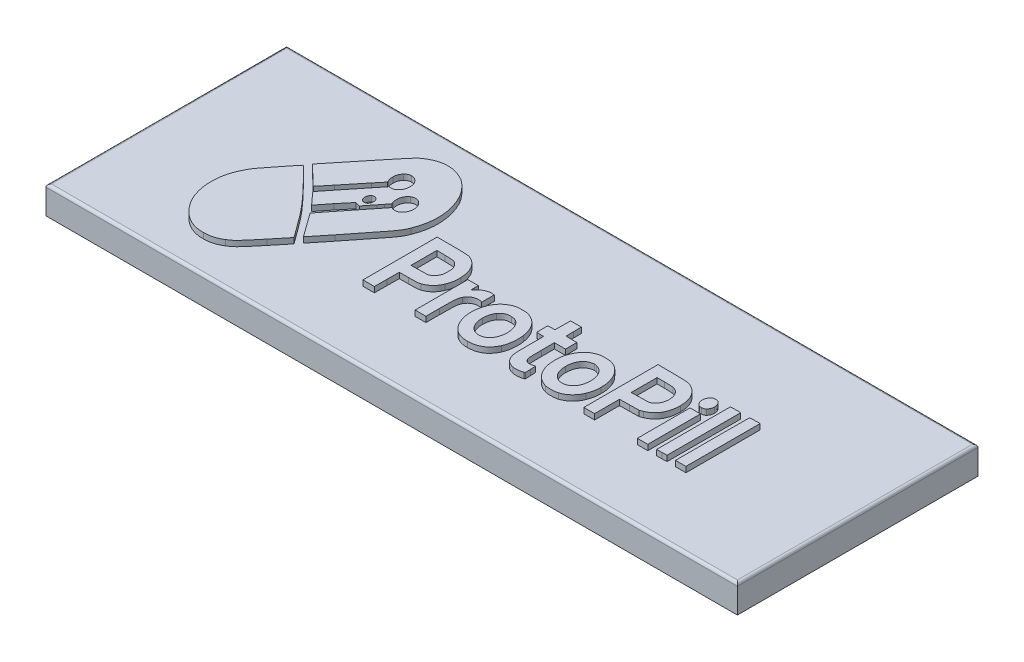
from build123d import *

# Parameters (mm, degrees)
SKETCH1_W           = 250
SKETCH1_H           = 87
BOSS_EXTRUDE1_DEPTH = 10
BOSS_EXTRUDE2_DEPTH = 2
SKETCH5_R           = 3.075
CUT_EXTRUDE1_DEPTH  = 3
FILLET1_R           = 1


with BuildPart() as part:
    # Sketch1 → Boss-Extrude1 (new body)
    with BuildSketch(Plane(origin=(0, 0, 0), x_dir=(1, 0, 0), z_dir=(0, 1, 0))):
        Rectangle(SKETCH1_W, SKETCH1_H)
    extrude(amount=BOSS_EXTRUDE1_DEPTH)

    # Sketch3 → Boss-Extrude2 (add)
    # profile 1 of 14: a face of its own
    with BuildSketch(Plane(origin=(0, 10, 0), x_dir=(1, 0, 0), z_dir=(0, 1, 0))):
        with BuildLine():
            add(Edge.make_bspline(
                [(-71.462865957, 20.776977785), (-75.096341957, 16.274388785), (-78.741614957, 11.771798785), (-79.567404957, 10.769655785)],
                knots=[0, 0, 0, 0, 1, 1, 1, 1], degree=3))
            Line((-79.567404957, 10.769655785), (-81.065623957, 8.920629785))
            Line((-81.065623957, 8.920629785), (-79.154509957, 7.085718785))
            add(Edge.make_bspline(
                [(-79.154509957, 7.085718785), (-78.104576957, 6.083574785), (-76.535575957, 4.545072785), (-75.662597957, 3.669960785)],
                knots=[0, 0, 0, 0, 1, 1, 1, 1], degree=3))
            add(Edge.make_bspline(
                [(-75.662597957, 3.669960785), (-74.789619957, 2.794849785), (-74.022814957, 2.103229785), (-73.952032957, 2.117343785)],
                knots=[0, 0, 0, 0, 1, 1, 1, 1], degree=3))
            add(Edge.make_bspline(
                [(-73.952032957, 2.117343785), (-73.869453957, 2.145573785), (-72.312249957, 4.036943785), (-70.471917957, 6.323524785)],
                knots=[0, 0, 0, 0, 1, 1, 1, 1], degree=3))
            add(Edge.make_bspline(
                [(-70.471917957, 6.323524785), (-68.619788957, 8.610105785), (-65.930072957, 11.927060785), (-64.467244957, 13.677283785)],
                knots=[0, 0, 0, 0, 1, 1, 1, 1], degree=3))
            Line((-64.467244957, 13.677283785), (-61.824716957, 16.867205785))
            Line((-61.824716957, 16.867205785), (-62.155032957, 17.558825785))
            add(Edge.make_bspline(
                [(-62.155032957, 17.558825785), (-62.449957957, 18.165757785), (-62.497145957, 18.391593785), (-62.497145957, 19.379622785)],
                knots=[0, 0, 0, 0, 1, 1, 1, 1], degree=3))
            add(Edge.make_bspline(
                [(-62.497145957, 19.379622785), (-62.497145957, 20.706403785), (-62.261205957, 21.355680785), (-61.494400957, 22.188447785)],
                knots=[0, 0, 0, 0, 1, 1, 1, 1], degree=3))
            add(Edge.make_bspline(
                [(-61.494400957, 22.188447785), (-60.833768957, 22.908297785), (-60.279309957, 23.162361785), (-59.429925957, 23.162361785)],
                knots=[0, 0, 0, 0, 1, 1, 1, 1], degree=3))
            add(Edge.make_bspline(
                [(-59.429925957, 23.162361785), (-58.545150957, 23.176476785), (-57.825533957, 22.809494785), (-57.164901957, 22.004956785)],
                knots=[0, 0, 0, 0, 1, 1, 1, 1], degree=3))
            add(Edge.make_bspline(
                [(-57.164901957, 22.004956785), (-56.480675957, 21.172188785), (-56.256532957, 20.424109785), (-56.327314957, 19.097328785)],
                knots=[0, 0, 0, 0, 1, 1, 1, 1], degree=3))
            add(Edge.make_bspline(
                [(-56.327314957, 19.097328785), (-56.374502957, 18.250446785), (-56.445284957, 17.925807785), (-56.716615957, 17.460022785)],
                knots=[0, 0, 0, 0, 1, 1, 1, 1], degree=3))
            add(Edge.make_bspline(
                [(-56.716615957, 17.460022785), (-57.424435957, 16.161470785), (-58.238428957, 15.610997785), (-59.429925957, 15.625111785)],
                knots=[0, 0, 0, 0, 1, 1, 1, 1], degree=3))
            Line((-59.429925957, 15.625111785), (-60.173136957, 15.625111785))
            Line((-60.173136957, 15.625111785), (-61.694949957, 13.705512785))
            add(Edge.make_bspline(
                [(-61.694949957, 13.705512785), (-62.520739957, 12.646910785), (-65.257643957, 9.231152785), (-67.770404957, 6.125918785)],
                knots=[0, 0, 0, 0, 1, 1, 1, 1], degree=3))
            add(Edge.make_bspline(
                [(-67.770404957, 6.125918785), (-70.294962957, 3.020684785), (-72.347640957, 0.437694785), (-72.347640957, 0.395350785)],
                knots=[0, 0, 0, 0, 1, 1, 1, 1], degree=3))
            add(Edge.make_bspline(
                [(-72.347640957, 0.395350785), (-72.347640957, 0.338891785), (-71.734196957, -0.380958215), (-70.979188957, -1.213725215)],
                knots=[0, 0, 0, 0, 1, 1, 1, 1], degree=3))
            Line((-70.979188957, -1.213725215), (-69.598939957, -2.752227215))
            Line((-69.598939957, -2.752227215), (-68.336660957, -4.107238215))
            add(Edge.make_bspline(
                [(-64.785763957, 0.395350785), (-66.732268957, -2.032377215), (-68.336660957, -4.050779215), (-68.336660957, -4.107238215)],
                knots=[0, 0, 0, 0, 1, 1, 1, 1], degree=3))
            add(Edge.make_bspline(
                [(-61.034317957, 4.700334785), (-61.175881957, 4.756792785), (-62.166829957, 3.627616785), (-64.785763957, 0.395350785)],
                knots=[0, 0, 0, 0, 1, 1, 1, 1], degree=3))
            add(Edge.make_bspline(
                [(-60.161339957, 4.432154785), (-60.538843957, 4.530957785), (-60.928144957, 4.643875785), (-61.034317957, 4.700334785)],
                knots=[0, 0, 0, 0, 1, 1, 1, 1], degree=3))
            Line((-60.161339957, 4.432154785), (-59.477113957, 4.262778785))
            Line((-59.477113957, 4.262778785), (-56.598645957, 7.847912785))
            Line((-56.598645957, 7.847912785), (-55.430742957, 9.344070785))
            Line((-55.430742957, 9.344070785), (-54.274636957, 10.854343785))
            Line((-54.274636957, 10.854343785), (-54.522373957, 11.545963785))
            add(Edge.make_bspline(
                [(-54.522373957, 11.545963785), (-55.171208957, 13.352645785), (-54.569561957, 15.455735785), (-53.130327957, 16.387305785)],
                knots=[0, 0, 0, 0, 1, 1, 1, 1], degree=3))
            add(Edge.make_bspline(
                [(-53.130327957, 16.387305785), (-51.903439957, 17.191843785), (-50.605769957, 16.980123785), (-49.555836957, 15.822717785)],
                knots=[0, 0, 0, 0, 1, 1, 1, 1], degree=3))
            add(Edge.make_bspline(
                [(-49.555836957, 15.822717785), (-47.892459957, 13.945462785), (-48.423324957, 10.572049785), (-50.570378957, 9.499331785)],
                knots=[0, 0, 0, 0, 1, 1, 1, 1], degree=3))
            add(Edge.make_bspline(
                [(-50.570378957, 9.499331785), (-51.065852957, 9.245267785), (-52.033206957, 9.231152785), (-52.646650957, 9.442873785)],
                knots=[0, 0, 0, 0, 1, 1, 1, 1], degree=3))
            Line((-52.646650957, 9.442873785), (-53.083139957, 9.598134785))
            Line((-53.083139957, 9.598134785), (-54.085884957, 8.356041785))
            add(Edge.make_bspline(
                [(-54.085884957, 8.356041785), (-54.994253957, 7.212750785), (-58.521556957, 2.766620785), (-63.995364957, -4.107238215)],
                knots=[0, 0, 0, 0, 1, 1, 1, 1], degree=3))
            add(Edge.make_bspline(
                [(-63.995364957, -4.107238215), (-65.151470957, -5.546938215), (-66.095230957, -6.789031215), (-66.095230957, -6.845490215)],
                knots=[0, 0, 0, 0, 1, 1, 1, 1], degree=3))
            add(Edge.make_bspline(
                [(-66.095230957, -6.845490215), (-66.095230957, -6.916064215), (-65.387410957, -7.932322215), (-64.526229957, -9.103842215)],
                knots=[0, 0, 0, 0, 1, 1, 1, 1], degree=3))
            add(Edge.make_bspline(
                [(-64.526229957, -9.103842215), (-63.665048957, -10.289477215), (-62.296596957, -12.166732215), (-61.506197957, -13.295908215)],
                knots=[0, 0, 0, 0, 1, 1, 1, 1], degree=3))
            add(Edge.make_bspline(
                [(-61.506197957, -13.295908215), (-60.704001957, -14.425084215), (-60.007978957, -15.384884215), (-59.972587957, -15.441342215)],
                knots=[0, 0, 0, 0, 1, 1, 1, 1], degree=3))
            add(Edge.make_bspline(
                [(-59.972587957, -15.441342215), (-59.925399957, -15.511916215), (-57.601390957, -12.674861215), (-54.817298957, -9.160301215)],
                knots=[0, 0, 0, 0, 1, 1, 1, 1], degree=3))
            add(Edge.make_bspline(
                [(-54.817298957, -9.160301215), (-44.011246957, 4.418040785), (-44.376953957, 3.909910785), (-43.220847957, 6.704621785)],
                knots=[0, 0, 0, 0, 1, 1, 1, 1], degree=3))
            add(Edge.make_bspline(
                [(-43.220847957, 6.704621785), (-40.731680957, 12.675139785), (-41.097387957, 19.436080785), (-44.223592957, 25.194878785)],
                knots=[0, 0, 0, 0, 1, 1, 1, 1], degree=3))
            add(Edge.make_bspline(
                [(-44.223592957, 25.194878785), (-45.391495957, 27.354427785), (-47.597534957, 29.768041785), (-49.473257957, 30.953675785)],
                knots=[0, 0, 0, 0, 1, 1, 1, 1], degree=3))
            add(Edge.make_bspline(
                [(-49.473257957, 30.953675785), (-50.511393957, 31.602952785), (-52.457898957, 32.365145785), (-53.755568957, 32.647440785)],
                knots=[0, 0, 0, 0, 1, 1, 1, 1], degree=3))
            add(Edge.make_bspline(
                [(-53.755568957, 32.647440785), (-55.029644957, 32.901504785), (-56.976149957, 32.901504785), (-58.250225957, 32.619210785)],
                knots=[0, 0, 0, 0, 1, 1, 1, 1], degree=3))
            add(Edge.make_bspline(
                [(-58.250225957, 32.619210785), (-60.255715957, 32.195769785), (-62.556130957, 31.010134785), (-64.089740957, 29.626894785)],
                knots=[0, 0, 0, 0, 1, 1, 1, 1], degree=3))
            add(Edge.make_bspline(
                [(-64.089740957, 29.626894785), (-64.514432957, 29.245797785), (-67.829389957, 25.265451785), (-71.462865957, 20.776977785)],
                knots=[0, 0, 0, 0, 1, 1, 1, 1], degree=3))
        make_face()
        with BuildLine():
            add(Edge.make_bspline(
                [(-58.887263957, 9.668708785), (-59.382737957, 10.063920785), (-60.007978957, 10.092149785), (-60.515249957, 9.711052785)],
                knots=[0, 0, 0, 0, 1, 1, 1, 1], degree=3))
            add(Edge.make_bspline(
                [(-58.191240957, 8.087861785), (-58.191240957, 8.821826785), (-58.391789957, 9.273496785), (-58.887263957, 9.668708785)],
                knots=[0, 0, 0, 0, 1, 1, 1, 1], degree=3))
            add(Edge.make_bspline(
                [(-60.373685957, 6.408212785), (-59.359143957, 5.829509785), (-58.191240957, 6.732850785), (-58.191240957, 8.087861785)],
                knots=[0, 0, 0, 0, 1, 1, 1, 1], degree=3))
            add(Edge.make_bspline(
                [(-60.515249957, 9.711052785), (-61.565182957, 8.948858785), (-61.482603957, 7.029259785), (-60.373685957, 6.408212785)],
                knots=[0, 0, 0, 0, 1, 1, 1, 1], degree=3))
        make_face(mode=Mode.SUBTRACT)
        with BuildLine():
            add(Edge.make_bspline(
                [(-64.655996957, 20.833436785), (-66.519922957, 18.292790785), (-67.640637957, 16.881320785), (-73.491949957, 9.668708785)],
                knots=[0, 0, 0, 0, 1, 1, 1, 1], degree=3))
            Line((-73.491949957, 9.668708785), (-75.756973957, 6.859883785))
            Line((-75.756973957, 6.859883785), (-76.653545957, 7.833797785))
            add(Edge.make_bspline(
                [(-76.653545957, 7.833797785), (-77.137222957, 8.356041785), (-77.538320957, 8.821826785), (-77.538320957, 8.864170785)],
                knots=[0, 0, 0, 0, 1, 1, 1, 1], degree=3))
            add(Edge.make_bspline(
                [(-77.538320957, 8.864170785), (-77.538320957, 8.906514785), (-75.509236957, 11.433045785), (-73.020069957, 14.453591785)],
                knots=[0, 0, 0, 0, 1, 1, 1, 1], degree=3))
            add(Edge.make_bspline(
                [(-73.020069957, 14.453591785), (-70.542699957, 17.488252785), (-67.345712957, 21.412138785), (-65.918275957, 23.176476785)],
                knots=[0, 0, 0, 0, 1, 1, 1, 1], degree=3))
            add(Edge.make_bspline(
                [(-65.918275957, 23.176476785), (-62.591521957, 27.297968785), (-61.565182957, 28.243653785), (-59.370940957, 29.203453785)],
                knots=[0, 0, 0, 0, 1, 1, 1, 1], degree=3))
            add(Edge.make_bspline(
                [(-59.370940957, 29.203453785), (-57.448029957, 30.036220785), (-55.418945957, 30.205596785), (-53.295485957, 29.683352785)],
                knots=[0, 0, 0, 0, 1, 1, 1, 1], degree=3))
            add(Edge.make_bspline(
                [(-53.295485957, 29.683352785), (-50.747333957, 29.048191785), (-48.470512957, 27.340312785), (-46.724556957, 24.714978785)],
                knots=[0, 0, 0, 0, 1, 1, 1, 1], degree=3))
            add(Edge.make_bspline(
                [(-46.724556957, 24.714978785), (-45.792593957, 23.317623785), (-44.813442957, 20.861665785), (-45.179149957, 20.861665785)],
                knots=[0, 0, 0, 0, 1, 1, 1, 1], degree=3))
            add(Edge.make_bspline(
                [(-45.179149957, 20.861665785), (-45.226337957, 20.861665785), (-45.745405957, 21.454482785), (-46.347052957, 22.188447785)],
                knots=[0, 0, 0, 0, 1, 1, 1, 1], degree=3))
            add(Edge.make_bspline(
                [(-46.347052957, 22.188447785), (-49.603024957, 26.140563785), (-54.085884957, 27.862556785), (-58.014285957, 26.648692785)],
                knots=[0, 0, 0, 0, 1, 1, 1, 1], degree=3))
            add(Edge.make_bspline(
                [(-58.014285957, 26.648692785), (-59.264767957, 26.267595785), (-60.916347957, 25.279566785), (-61.871904957, 24.319767785)],
                knots=[0, 0, 0, 0, 1, 1, 1, 1], degree=3))
            add(Edge.make_bspline(
                [(-61.871904957, 24.319767785), (-62.308393957, 23.896326785), (-63.558875957, 22.329594785), (-64.655996957, 20.833436785)],
                knots=[0, 0, 0, 0, 1, 1, 1, 1], degree=3))
        make_face(mode=Mode.SUBTRACT)
    # profile 2 of 14: a face of its own
    with BuildSketch(Plane(origin=(0, 10, 0), x_dir=(1, 0, 0), z_dir=(0, 1, 0))):
        with BuildLine():
            Line((-75.756973957, 6.859883785), (-73.491949957, 9.668708785))
            add(Edge.make_bspline(
                [(-64.655996957, 20.833436785), (-66.519922957, 18.292790785), (-67.640637957, 16.881320785), (-73.491949957, 9.668708785)],
                knots=[0, 0, 0, 0, 1, 1, 1, 1], degree=3))
            add(Edge.make_bspline(
                [(-61.871904957, 24.319767785), (-62.308393957, 23.896326785), (-63.558875957, 22.329594785), (-64.655996957, 20.833436785)],
                knots=[0, 0, 0, 0, 1, 1, 1, 1], degree=3))
            add(Edge.make_bspline(
                [(-58.014285957, 26.648692785), (-59.264767957, 26.267595785), (-60.916347957, 25.279566785), (-61.871904957, 24.319767785)],
                knots=[0, 0, 0, 0, 1, 1, 1, 1], degree=3))
            add(Edge.make_bspline(
                [(-46.347052957, 22.188447785), (-49.603024957, 26.140563785), (-54.085884957, 27.862556785), (-58.014285957, 26.648692785)],
                knots=[0, 0, 0, 0, 1, 1, 1, 1], degree=3))
            add(Edge.make_bspline(
                [(-45.179149957, 20.861665785), (-45.226337957, 20.861665785), (-45.745405957, 21.454482785), (-46.347052957, 22.188447785)],
                knots=[0, 0, 0, 0, 1, 1, 1, 1], degree=3))
            add(Edge.make_bspline(
                [(-46.724556957, 24.714978785), (-45.792593957, 23.317623785), (-44.813442957, 20.861665785), (-45.179149957, 20.861665785)],
                knots=[0, 0, 0, 0, 1, 1, 1, 1], degree=3))
            add(Edge.make_bspline(
                [(-53.295485957, 29.683352785), (-50.747333957, 29.048191785), (-48.470512957, 27.340312785), (-46.724556957, 24.714978785)],
                knots=[0, 0, 0, 0, 1, 1, 1, 1], degree=3))
            add(Edge.make_bspline(
                [(-59.370940957, 29.203453785), (-57.448029957, 30.036220785), (-55.418945957, 30.205596785), (-53.295485957, 29.683352785)],
                knots=[0, 0, 0, 0, 1, 1, 1, 1], degree=3))
            add(Edge.make_bspline(
                [(-65.918275957, 23.176476785), (-62.591521957, 27.297968785), (-61.565182957, 28.243653785), (-59.370940957, 29.203453785)],
                knots=[0, 0, 0, 0, 1, 1, 1, 1], degree=3))
            add(Edge.make_bspline(
                [(-73.020069957, 14.453591785), (-70.542699957, 17.488252785), (-67.345712957, 21.412138785), (-65.918275957, 23.176476785)],
                knots=[0, 0, 0, 0, 1, 1, 1, 1], degree=3))
            add(Edge.make_bspline(
                [(-77.538320957, 8.864170785), (-77.538320957, 8.906514785), (-75.509236957, 11.433045785), (-73.020069957, 14.453591785)],
                knots=[0, 0, 0, 0, 1, 1, 1, 1], degree=3))
            add(Edge.make_bspline(
                [(-76.653545957, 7.833797785), (-77.137222957, 8.356041785), (-77.538320957, 8.821826785), (-77.538320957, 8.864170785)],
                knots=[0, 0, 0, 0, 1, 1, 1, 1], degree=3))
            Line((-76.653545957, 7.833797785), (-75.756973957, 6.859883785))
        make_face()
    # profile 3 of 14: a face of its own
    with BuildSketch(Plane(origin=(0, 10, 0), x_dir=(1, 0, 0), z_dir=(0, 1, 0))):
        with BuildLine():
            Line((-35.658970957, 8.581876785), (-35.658970957, -4.827088215))
            Line((-35.658970957, -4.827088215), (-35.658970957, -18.236053215))
            Line((-35.658970957, -18.236053215), (-33.594495957, -18.236053215))
            Line((-33.594495957, -18.236053215), (-31.530020957, -18.236053215))
            Line((-31.530020957, -18.236053215), (-31.506426957, -13.747578215))
            Line((-31.506426957, -13.747578215), (-31.471035957, -9.273218215))
            Line((-31.471035957, -9.273218215), (-28.167875957, -9.259104215))
            add(Edge.make_bspline(
                [(-28.167875957, -9.259104215), (-25.195031957, -9.244989215), (-24.770339957, -9.216760215), (-23.944549957, -8.948580215)],
                knots=[0, 0, 0, 0, 1, 1, 1, 1], degree=3))
            add(Edge.make_bspline(
                [(-23.944549957, -8.948580215), (-21.915465957, -8.285189215), (-20.381855957, -6.817261215), (-19.508877957, -4.685941215)],
                knots=[0, 0, 0, 0, 1, 1, 1, 1], degree=3))
            add(Edge.make_bspline(
                [(-19.508877957, -4.685941215), (-18.848245957, -3.062750215), (-18.635899957, -1.778313215), (-18.706681957, 0.183630785)],
                knots=[0, 0, 0, 0, 1, 1, 1, 1], degree=3))
            add(Edge.make_bspline(
                [(-18.706681957, 0.183630785), (-18.836448957, 3.698190785), (-20.157712957, 6.281180785), (-22.505315957, 7.678535785)],
                knots=[0, 0, 0, 0, 1, 1, 1, 1], degree=3))
            add(Edge.make_bspline(
                [(-22.505315957, 7.678535785), (-23.956346957, 8.525417785), (-24.369241957, 8.581876785), (-30.314929957, 8.581876785)],
                knots=[0, 0, 0, 0, 1, 1, 1, 1], degree=3))
            Line((-30.314929957, 8.581876785), (-35.658970957, 8.581876785))
        make_face()
        with BuildLine():
            add(Edge.make_bspline(
                [(-23.106962957, -2.441704215), (-23.472669957, -3.373274215), (-24.027128957, -4.050779215), (-24.782136957, -4.502450215)],
                knots=[0, 0, 0, 0, 1, 1, 1, 1], degree=3))
            Line((-24.782136957, -4.502450215), (-25.454565957, -4.897662215))
            Line((-25.454565957, -4.897662215), (-28.486394957, -4.940006215))
            Line((-28.486394957, -4.940006215), (-31.530020957, -4.982350215))
            Line((-31.530020957, -4.982350215), (-31.530020957, -0.310384215))
            Line((-31.530020957, -0.310384215), (-31.530020957, 4.375695785))
            Line((-31.530020957, 4.375695785), (-28.545379957, 4.319237785))
            add(Edge.make_bspline(
                [(-28.545379957, 4.319237785), (-26.079806957, 4.262778785), (-25.478159957, 4.220434785), (-25.029873957, 4.008713785)],
                knots=[0, 0, 0, 0, 1, 1, 1, 1], degree=3))
            add(Edge.make_bspline(
                [(-25.029873957, 4.008713785), (-24.286662957, 3.684075785), (-23.567045957, 2.907767785), (-23.177744957, 2.032655785)],
                knots=[0, 0, 0, 0, 1, 1, 1, 1], degree=3))
            add(Edge.make_bspline(
                [(-23.177744957, 2.032655785), (-22.882819957, 1.383379785), (-22.859225957, 1.171658785), (-22.859225957, -0.239811215)],
                knots=[0, 0, 0, 0, 1, 1, 1, 1], degree=3))
            add(Edge.make_bspline(
                [(-22.859225957, -0.239811215), (-22.859225957, -1.524248215), (-22.906413957, -1.905345215), (-23.106962957, -2.441704215)],
                knots=[0, 0, 0, 0, 1, 1, 1, 1], degree=3))
        make_face(mode=Mode.SUBTRACT)
    # profile 4 of 14: a face of its own
    with BuildSketch(Plane(origin=(0, 10, 0), x_dir=(1, 0, 0), z_dir=(0, 1, 0))):
        with BuildLine():
            Line((44.206719043, 8.595991785), (44.206719043, -4.812973215))
            Line((44.206719043, -4.812973215), (44.206719043, -18.236053215))
            Line((44.206719043, -18.236053215), (46.153224043, -18.236053215))
            Line((46.153224043, -18.236053215), (48.099729043, -18.236053215))
            Line((48.099729043, -18.236053215), (48.099729043, -13.733464215))
            Line((48.099729043, -13.733464215), (48.099729043, -9.230874215))
            Line((48.099729043, -9.230874215), (51.615235043, -9.174416215))
            Line((51.615235043, -9.174416215), (55.118944043, -9.117957215))
            Line((55.118944043, -9.117957215), (56.227862043, -8.666286215))
            add(Edge.make_bspline(
                [(56.227862043, -8.666286215), (59.436646043, -7.339505215), (61.123617043, -4.431876215), (61.123617043, -0.239811215)],
                knots=[0, 0, 0, 0, 1, 1, 1, 1], degree=3))
            add(Edge.make_bspline(
                [(61.123617043, -0.239811215), (61.123617043, 2.413752785), (60.462985043, 4.375695785), (59.023751043, 6.013001785)],
                knots=[0, 0, 0, 0, 1, 1, 1, 1], degree=3))
            add(Edge.make_bspline(
                [(59.023751043, 6.013001785), (58.044600043, 7.113947785), (57.089043043, 7.763223785), (55.803170043, 8.186664785)],
                knots=[0, 0, 0, 0, 1, 1, 1, 1], degree=3))
            add(Edge.make_bspline(
                [(55.803170043, 8.186664785), (54.930192043, 8.483073785), (54.576282043, 8.497188785), (49.550760043, 8.553647785)],
                knots=[0, 0, 0, 0, 1, 1, 1, 1], degree=3))
            Line((49.550760043, 8.553647785), (44.206719043, 8.595991785))
        make_face()
        with BuildLine():
            add(Edge.make_bspline(
                [(55.024568043, -4.558909215), (54.434718043, -4.883547215), (54.269560043, -4.897662215), (51.261325043, -4.940006215)],
                knots=[0, 0, 0, 0, 1, 1, 1, 1], degree=3))
            Line((51.261325043, -4.940006215), (48.099729043, -4.982350215))
            Line((48.099729043, -4.982350215), (48.099729043, -0.324499215))
            Line((48.099729043, -0.324499215), (48.099729043, 4.347466785))
            Line((48.099729043, 4.347466785), (50.718663043, 4.347466785))
            add(Edge.make_bspline(
                [(50.718663043, 4.347466785), (52.157897043, 4.347466785), (53.667913043, 4.276893785), (54.069011043, 4.192204785)],
                knots=[0, 0, 0, 0, 1, 1, 1, 1], degree=3))
            add(Edge.make_bspline(
                [(54.069011043, 4.192204785), (55.543636043, 3.881681785), (56.640757043, 2.696046785), (57.006464043, 1.030512785)],
                knots=[0, 0, 0, 0, 1, 1, 1, 1], degree=3))
            add(Edge.make_bspline(
                [(57.006464043, 1.030512785), (57.242404043, -0.098663215), (57.230607043, -0.804398215), (56.935682043, -1.933575215)],
                knots=[0, 0, 0, 0, 1, 1, 1, 1], degree=3))
            add(Edge.make_bspline(
                [(56.935682043, -1.933575215), (56.640757043, -3.105095215), (55.932937043, -4.079009215), (55.024568043, -4.558909215)],
                knots=[0, 0, 0, 0, 1, 1, 1, 1], degree=3))
        make_face(mode=Mode.SUBTRACT)
    # profile 5 of 14: a face of its own
    with BuildSketch(Plane(origin=(0, 10, 0), x_dir=(1, 0, 0), z_dir=(0, 1, 0))):
        with BuildLine():
            add(Edge.make_bspline(
                [(72.755459043, 8.497188785), (71.941466043, 8.511303785), (71.103879043, 8.497188785), (70.903330043, 8.468958785)],
                knots=[0, 0, 0, 0, 1, 1, 1, 1], degree=3))
            Line((70.903330043, 8.468958785), (70.514029043, 8.426614785))
            Line((70.514029043, 8.426614785), (70.514029043, -4.911776215))
            Line((70.514029043, -4.911776215), (70.514029043, -18.250168215))
            Line((70.514029043, -18.250168215), (72.377955043, -18.207824215))
            Line((72.377955043, -18.207824215), (74.230084043, -18.165479215))
            Line((74.230084043, -18.165479215), (74.230084043, -4.841203215))
            Line((74.230084043, -4.841203215), (74.230084043, 8.483073785))
            Line((74.230084043, 8.483073785), (72.755459043, 8.497188785))
        make_face()
    # profile 6 of 14: a face of its own
    with BuildSketch(Plane(origin=(0, 10, 0), x_dir=(1, 0, 0), z_dir=(0, 1, 0))):
        with BuildLine():
            add(Edge.make_bspline(
                [(77.427071043, 8.468958785), (77.391680043, 8.426614785), (77.356289043, 2.399637785), (77.356289043, -4.925891215)],
                knots=[0, 0, 0, 0, 1, 1, 1, 1], degree=3))
            Line((77.356289043, -4.925891215), (77.356289043, -18.236053215))
            Line((77.356289043, -18.236053215), (79.243809043, -18.236053215))
            Line((79.243809043, -18.236053215), (81.131329043, -18.236053215))
            Line((81.131329043, -18.236053215), (81.131329043, -4.827088215))
            Line((81.131329043, -4.827088215), (81.131329043, 8.595991785))
            Line((81.131329043, 8.595991785), (79.314591043, 8.567761785))
            add(Edge.make_bspline(
                [(79.314591043, 8.567761785), (78.311846043, 8.567761785), (77.462462043, 8.525417785), (77.427071043, 8.468958785)],
                knots=[0, 0, 0, 0, 1, 1, 1, 1], degree=3))
        make_face()
    # profile 7 of 14: a face of its own
    with BuildSketch(Plane(origin=(0, 10, 0), x_dir=(1, 0, 0), z_dir=(0, 1, 0))):
        with BuildLine():
            add(Edge.make_bspline(
                [(-73.102648957, -30.431154215), (-71.203331957, -29.273748215), (-70.448323957, -28.483325215), (-65.812102957, -22.823331215)],
                knots=[0, 0, 0, 0, 1, 1, 1, 1], degree=3))
            Line((-65.812102957, -22.823331215), (-61.400024957, -17.445630215))
            Line((-61.400024957, -17.445630215), (-62.709491957, -15.610719215))
            add(Edge.make_bspline(
                [(-62.709491957, -15.610719215), (-67.086178957, -9.484939215), (-69.174247957, -6.845490215), (-72.701550957, -2.992177215)],
                knots=[0, 0, 0, 0, 1, 1, 1, 1], degree=3))
            add(Edge.make_bspline(
                [(-72.701550957, -2.992177215), (-75.780567957, 0.381235785), (-81.962195957, 6.676392785), (-82.375090957, 6.859883785)],
                knots=[0, 0, 0, 0, 1, 1, 1, 1], degree=3))
            add(Edge.make_bspline(
                [(-82.375090957, 6.859883785), (-82.422278957, 6.873997785), (-84.097452957, 4.827366785), (-86.102942957, 2.286720785)],
                knots=[0, 0, 0, 0, 1, 1, 1, 1], degree=3))
            add(Edge.make_bspline(
                [(-86.102942957, 2.286720785), (-88.108432957, -0.253925215), (-89.972358957, -2.653424215), (-90.255486957, -3.048636215)],
                knots=[0, 0, 0, 0, 1, 1, 1, 1], degree=3))
            add(Edge.make_bspline(
                [(-90.255486957, -3.048636215), (-91.458780957, -4.756514215), (-92.662074957, -7.410078215), (-93.287315957, -9.696659215)],
                knots=[0, 0, 0, 0, 1, 1, 1, 1], degree=3))
            add(Edge.make_bspline(
                [(-93.287315957, -9.696659215), (-94.172090957, -12.971270215), (-94.148496957, -16.937501215), (-93.228330957, -20.240340215)],
                knots=[0, 0, 0, 0, 1, 1, 1, 1], degree=3))
            add(Edge.make_bspline(
                [(-93.228330957, -20.240340215), (-92.520510957, -22.780986215), (-91.494171957, -24.785274215), (-89.889779957, -26.789561215)],
                knots=[0, 0, 0, 0, 1, 1, 1, 1], degree=3))
            add(Edge.make_bspline(
                [(-89.889779957, -26.789561215), (-86.928732957, -30.501727215), (-83.519399957, -32.266065215), (-79.366855957, -32.251950215)],
                knots=[0, 0, 0, 0, 1, 1, 1, 1], degree=3))
            add(Edge.make_bspline(
                [(-79.366855957, -32.251950215), (-77.019252957, -32.237835215), (-75.202514957, -31.715591215), (-73.102648957, -30.431154215)],
                knots=[0, 0, 0, 0, 1, 1, 1, 1], degree=3))
        make_face()
        with BuildLine():
            add(Edge.make_bspline(
                [(-90.338065957, -7.141899215), (-89.701027957, -5.801002215), (-89.075786957, -4.911776215), (-85.560280957, -0.507990215)],
                knots=[0, 0, 0, 0, 1, 1, 1, 1], degree=3))
            Line((-85.560280957, -0.507990215), (-82.339699957, 3.528813785))
            Line((-82.339699957, 3.528813785), (-81.419533957, 2.427867785))
            Line((-81.419533957, 2.427867785), (-80.499367957, 1.341035785))
            Line((-80.499367957, 1.341035785), (-81.230781957, 0.381235785))
            add(Edge.make_bspline(
                [(-81.230781957, 0.381235785), (-81.631879957, -0.141008215), (-82.870564957, -1.735969215), (-83.991279957, -3.161553215)],
                knots=[0, 0, 0, 0, 1, 1, 1, 1], degree=3))
            add(Edge.make_bspline(
                [(-83.991279957, -3.161553215), (-85.100197957, -4.587138215), (-86.386070957, -6.280902215), (-86.834356957, -6.930178215)],
                knots=[0, 0, 0, 0, 1, 1, 1, 1], degree=3))
            add(Edge.make_bspline(
                [(-86.834356957, -6.930178215), (-88.828049957, -9.809577215), (-89.901576957, -12.928926215), (-90.125719957, -16.542289215)],
                knots=[0, 0, 0, 0, 1, 1, 1, 1], degree=3))
            add(Edge.make_bspline(
                [(-90.125719957, -16.542289215), (-90.220095957, -17.981988215), (-90.231892957, -18.024332215), (-90.503223957, -18.024332215)],
                knots=[0, 0, 0, 0, 1, 1, 1, 1], degree=3))
            add(Edge.make_bspline(
                [(-90.503223957, -18.024332215), (-90.750960957, -18.024332215), (-90.845336957, -17.897300215), (-91.057682957, -17.248024215)],
                knots=[0, 0, 0, 0, 1, 1, 1, 1], degree=3))
            add(Edge.make_bspline(
                [(-91.057682957, -17.248024215), (-91.423389957, -16.161192215), (-91.694720957, -14.481543215), (-91.694720957, -13.324137215)],
                knots=[0, 0, 0, 0, 1, 1, 1, 1], degree=3))
            add(Edge.make_bspline(
                [(-91.694720957, -13.324137215), (-91.694720957, -11.404538215), (-91.128464957, -8.835663215), (-90.338065957, -7.141899215)],
                knots=[0, 0, 0, 0, 1, 1, 1, 1], degree=3))
        make_face(mode=Mode.SUBTRACT)
    # profile 8 of 14: a face of its own
    with BuildSketch(Plane(origin=(0, 10, 0), x_dir=(1, 0, 0), z_dir=(0, 1, 0))):
        with BuildLine():
            Line((-82.339699957, 3.528813785), (-85.560280957, -0.507990215))
            add(Edge.make_bspline(
                [(-90.338065957, -7.141899215), (-89.701027957, -5.801002215), (-89.075786957, -4.911776215), (-85.560280957, -0.507990215)],
                knots=[0, 0, 0, 0, 1, 1, 1, 1], degree=3))
            add(Edge.make_bspline(
                [(-91.694720957, -13.324137215), (-91.694720957, -11.404538215), (-91.128464957, -8.835663215), (-90.338065957, -7.141899215)],
                knots=[0, 0, 0, 0, 1, 1, 1, 1], degree=3))
            add(Edge.make_bspline(
                [(-91.057682957, -17.248024215), (-91.423389957, -16.161192215), (-91.694720957, -14.481543215), (-91.694720957, -13.324137215)],
                knots=[0, 0, 0, 0, 1, 1, 1, 1], degree=3))
            add(Edge.make_bspline(
                [(-90.503223957, -18.024332215), (-90.750960957, -18.024332215), (-90.845336957, -17.897300215), (-91.057682957, -17.248024215)],
                knots=[0, 0, 0, 0, 1, 1, 1, 1], degree=3))
            add(Edge.make_bspline(
                [(-90.125719957, -16.542289215), (-90.220095957, -17.981988215), (-90.231892957, -18.024332215), (-90.503223957, -18.024332215)],
                knots=[0, 0, 0, 0, 1, 1, 1, 1], degree=3))
            add(Edge.make_bspline(
                [(-86.834356957, -6.930178215), (-88.828049957, -9.809577215), (-89.901576957, -12.928926215), (-90.125719957, -16.542289215)],
                knots=[0, 0, 0, 0, 1, 1, 1, 1], degree=3))
            add(Edge.make_bspline(
                [(-83.991279957, -3.161553215), (-85.100197957, -4.587138215), (-86.386070957, -6.280902215), (-86.834356957, -6.930178215)],
                knots=[0, 0, 0, 0, 1, 1, 1, 1], degree=3))
            add(Edge.make_bspline(
                [(-81.230781957, 0.381235785), (-81.631879957, -0.141008215), (-82.870564957, -1.735969215), (-83.991279957, -3.161553215)],
                knots=[0, 0, 0, 0, 1, 1, 1, 1], degree=3))
            Line((-81.230781957, 0.381235785), (-80.499367957, 1.341035785))
            Line((-80.499367957, 1.341035785), (-81.419533957, 2.427867785))
            Line((-81.419533957, 2.427867785), (-82.339699957, 3.528813785))
        make_face()
    # profile 9 of 14: a face of its own
    with BuildSketch(Plane(origin=(0, 10, 0), x_dir=(1, 0, 0), z_dir=(0, 1, 0))):
        with BuildLine():
            Line((14.714219043, 6.464671785), (14.690625043, 3.684075785))
            Line((14.690625043, 3.684075785), (14.655234043, 0.889365785))
            Line((14.655234043, 0.889365785), (13.381158043, 0.847020785))
            Line((13.381158043, 0.847020785), (12.107082043, 0.804676785))
            Line((12.107082043, 0.804676785), (12.142473043, -1.199610215))
            Line((12.142473043, -1.199610215), (12.177864043, -3.203897215))
            Line((12.177864043, -3.203897215), (13.451940043, -3.246242215))
            Line((13.451940043, -3.246242215), (14.714219043, -3.288586215))
            Line((14.714219043, -3.288586215), (14.714219043, -8.398107215))
            add(Edge.make_bspline(
                [(14.714219043, -8.398107215), (14.714219043, -12.928926215), (14.737813043, -13.620546215), (14.926565043, -14.453313215)],
                knots=[0, 0, 0, 0, 1, 1, 1, 1], degree=3))
            add(Edge.make_bspline(
                [(14.926565043, -14.453313215), (15.469227043, -16.782239215), (16.719709043, -18.038447215), (18.843169043, -18.405429215)],
                knots=[0, 0, 0, 0, 1, 1, 1, 1], degree=3))
            add(Edge.make_bspline(
                [(18.843169043, -18.405429215), (19.845914043, -18.574806215), (21.332336043, -18.433659215), (22.276096043, -18.080791215)],
                knots=[0, 0, 0, 0, 1, 1, 1, 1], degree=3))
            Line((22.276096043, -18.080791215), (22.688991043, -17.925530215))
            Line((22.688991043, -17.925530215), (22.641803043, -15.991816215))
            add(Edge.make_bspline(
                [(22.641803043, -15.991816215), (22.618209043, -14.933213215), (22.582818043, -14.058102215), (22.559224043, -14.029872215)],
                knots=[0, 0, 0, 0, 1, 1, 1, 1], degree=3))
            add(Edge.make_bspline(
                [(22.559224043, -14.029872215), (22.547427043, -14.015758215), (22.228908043, -14.086331215), (21.839607043, -14.213363215)],
                knots=[0, 0, 0, 0, 1, 1, 1, 1], degree=3))
            add(Edge.make_bspline(
                [(21.839607043, -14.213363215), (20.459358043, -14.636805215), (19.468410043, -14.340396215), (18.949342043, -13.352367215)],
                knots=[0, 0, 0, 0, 1, 1, 1, 1], degree=3))
            add(Edge.make_bspline(
                [(18.949342043, -13.352367215), (18.666214043, -12.801893215), (18.666214043, -12.787779215), (18.630823043, -8.031125215)],
                knots=[0, 0, 0, 0, 1, 1, 1, 1], degree=3))
            Line((18.630823043, -8.031125215), (18.595432043, -3.274471215))
            Line((18.595432043, -3.274471215), (20.600922043, -3.274471215))
            Line((20.600922043, -3.274471215), (22.618209043, -3.274471215))
            Line((22.618209043, -3.274471215), (22.618209043, -1.227839215))
            Line((22.618209043, -1.227839215), (22.618209043, 0.818791785))
            Line((22.618209043, 0.818791785), (20.648110043, 0.847020785))
            Line((20.648110043, 0.847020785), (18.666214043, 0.889365785))
            Line((18.666214043, 0.889365785), (18.630823043, 3.684075785))
            Line((18.630823043, 3.684075785), (18.607229043, 6.464671785))
            Line((18.607229043, 6.464671785), (16.660724043, 6.464671785))
            Line((16.660724043, 6.464671785), (14.714219043, 6.464671785))
        make_face()
    # profile 10 of 14: a face of its own
    with BuildSketch(Plane(origin=(0, 10, 0), x_dir=(1, 0, 0), z_dir=(0, 1, 0))):
        with BuildLine():
            add(Edge.make_bspline(
                [(-12.949745957, -1.863001215), (-12.985136957, -1.863001215), (-13.008730957, -1.256069215), (-13.008730957, -0.522104215)],
                knots=[0, 0, 0, 0, 1, 1, 1, 1], degree=3))
            Line((-13.008730957, -0.522104215), (-13.008730957, 0.818791785))
            Line((-13.008730957, 0.818791785), (-14.896250957, 0.818791785))
            Line((-14.896250957, 0.818791785), (-16.783770957, 0.818791785))
            Line((-16.783770957, 0.818791785), (-16.783770957, -8.708631215))
            Line((-16.783770957, -8.708631215), (-16.783770957, -18.236053215))
            Line((-16.783770957, -18.236053215), (-14.837265957, -18.236053215))
            Line((-14.837265957, -18.236053215), (-12.890760957, -18.236053215))
            Line((-12.890760957, -18.236053215), (-12.890760957, -13.253564215))
            add(Edge.make_bspline(
                [(-12.890760957, -13.253564215), (-12.890760957, -7.847634215), (-12.808181957, -6.873719215), (-12.241925957, -5.744544215)],
                knots=[0, 0, 0, 0, 1, 1, 1, 1], degree=3))
            add(Edge.make_bspline(
                [(-12.241925957, -5.744544215), (-11.427932957, -4.064894215), (-9.469630957, -3.147439215), (-7.664689957, -3.599109215)],
                knots=[0, 0, 0, 0, 1, 1, 1, 1], degree=3))
            Line((-7.664689957, -3.599109215), (-7.228200957, -3.712027215))
            Line((-7.228200957, -3.712027215), (-7.228200957, -1.439560215))
            Line((-7.228200957, -1.439560215), (-7.228200957, 0.818791785))
            Line((-7.228200957, 0.818791785), (-7.511328957, 0.818791785))
            add(Edge.make_bspline(
                [(-7.511328957, 0.818791785), (-7.664689957, 0.818791785), (-7.865238957, 0.847020785), (-7.959614957, 0.875250785)],
                knots=[0, 0, 0, 0, 1, 1, 1, 1], degree=3))
            add(Edge.make_bspline(
                [(-7.959614957, 0.875250785), (-8.042193957, 0.903479785), (-8.455088957, 0.875250785), (-8.879780957, 0.818791785)],
                knots=[0, 0, 0, 0, 1, 1, 1, 1], degree=3))
            add(Edge.make_bspline(
                [(-8.879780957, 0.818791785), (-10.260029957, 0.621185785), (-11.557699957, -0.126893215), (-12.395286957, -1.213725215)],
                knots=[0, 0, 0, 0, 1, 1, 1, 1], degree=3))
            add(Edge.make_bspline(
                [(-12.395286957, -1.213725215), (-12.666617957, -1.566592215), (-12.926151957, -1.863001215), (-12.949745957, -1.863001215)],
                knots=[0, 0, 0, 0, 1, 1, 1, 1], degree=3))
        make_face()
    # profile 11 of 14: a face of its own
    with BuildSketch(Plane(origin=(0, 10, 0), x_dir=(1, 0, 0), z_dir=(0, 1, 0))):
        Polygon((63.553799043, 0.818791785), (63.553799043, -8.708631215), (63.553799043, -18.236053215), (65.441319043, -18.236053215), (67.328839043, -18.236053215), (67.328839043, -8.708631215), (67.328839043, 0.818791785), (65.441319043, 0.818791785), align=None)
    # profile 12 of 14: a face of its own
    with BuildSketch(Plane(origin=(0, 10, 0), x_dir=(1, 0, 0), z_dir=(0, 1, 0))):
        with BuildLine():
            add(Edge.make_bspline(
                [(66.420470043, 7.960829785), (65.983981043, 8.186664785), (65.052018043, 8.200779785), (64.615529043, 8.003173785)],
                knots=[0, 0, 0, 0, 1, 1, 1, 1], degree=3))
            add(Edge.make_bspline(
                [(64.615529043, 8.003173785), (63.424032043, 7.438585785), (62.904964043, 5.561330785), (63.577393043, 4.192204785)],
                knots=[0, 0, 0, 0, 1, 1, 1, 1], degree=3))
            add(Edge.make_bspline(
                [(63.577393043, 4.192204785), (64.025679043, 3.274749785), (64.662717043, 2.893652785), (65.618274043, 2.964225785)],
                knots=[0, 0, 0, 0, 1, 1, 1, 1], degree=3))
            add(Edge.make_bspline(
                [(65.618274043, 2.964225785), (66.243515043, 3.006570785), (66.455861043, 3.091258785), (66.821568043, 3.444125785)],
                knots=[0, 0, 0, 0, 1, 1, 1, 1], degree=3))
            add(Edge.make_bspline(
                [(66.821568043, 3.444125785), (67.399621043, 3.994599785), (67.682749043, 4.672104785), (67.682749043, 5.504871785)],
                knots=[0, 0, 0, 0, 1, 1, 1, 1], degree=3))
            add(Edge.make_bspline(
                [(67.682749043, 5.504871785), (67.682749043, 6.648162785), (67.222666043, 7.551503785), (66.420470043, 7.960829785)],
                knots=[0, 0, 0, 0, 1, 1, 1, 1], degree=3))
        make_face()
    # profile 13 of 14: a face of its own
    with BuildSketch(Plane(origin=(0, 10, 0), x_dir=(1, 0, 0), z_dir=(0, 1, 0))):
        with BuildLine():
            add(Edge.make_bspline(
                [(2.799249043, 1.185773785), (1.619549043, 1.228117785), (0.864541043, 1.171658785), (0.369067043, 1.044626785)],
                knots=[0, 0, 0, 0, 1, 1, 1, 1], degree=3))
            add(Edge.make_bspline(
                [(0.369067043, 1.044626785), (-2.532994957, 0.254203785), (-4.597469957, -1.891230215), (-5.517635957, -5.067038215)],
                knots=[0, 0, 0, 0, 1, 1, 1, 1], degree=3))
            add(Edge.make_bspline(
                [(-5.517635957, -5.067038215), (-6.968666957, -10.049527215), (-5.328883957, -15.413113215), (-1.719001957, -17.530318215)],
                knots=[0, 0, 0, 0, 1, 1, 1, 1], degree=3))
            add(Edge.make_bspline(
                [(-1.719001957, -17.530318215), (-0.433128957, -18.278397215), (0.640398043, -18.546576215), (2.386354043, -18.546576215)],
                knots=[0, 0, 0, 0, 1, 1, 1, 1], degree=3))
            add(Edge.make_bspline(
                [(2.386354043, -18.546576215), (6.008033043, -18.560691215), (8.544388043, -16.951615215), (9.983622043, -13.733464215)],
                knots=[0, 0, 0, 0, 1, 1, 1, 1], degree=3))
            add(Edge.make_bspline(
                [(9.983622043, -13.733464215), (10.809412043, -11.870323215), (11.127931043, -9.075613215), (10.774021043, -6.690228215)],
                knots=[0, 0, 0, 0, 1, 1, 1, 1], degree=3))
            add(Edge.make_bspline(
                [(10.774021043, -6.690228215), (10.231359043, -2.949833215), (8.438215043, -0.437416215), (5.488965043, 0.748218785)],
                knots=[0, 0, 0, 0, 1, 1, 1, 1], degree=3))
            add(Edge.make_bspline(
                [(5.488965043, 0.748218785), (4.639581043, 1.086970785), (4.285671043, 1.143429785), (2.799249043, 1.185773785)],
                knots=[0, 0, 0, 0, 1, 1, 1, 1], degree=3))
        make_face()
        with BuildLine():
            add(Edge.make_bspline(
                [(2.622294043, -2.893374215), (3.613242043, -2.921603215), (3.908167043, -2.978062215), (4.474423043, -3.302700215)],
                knots=[0, 0, 0, 0, 1, 1, 1, 1], degree=3))
            add(Edge.make_bspline(
                [(4.474423043, -3.302700215), (5.795687043, -4.036665215), (6.562492043, -5.335217215), (6.904605043, -7.424193215)],
                knots=[0, 0, 0, 0, 1, 1, 1, 1], degree=3))
            add(Edge.make_bspline(
                [(6.904605043, -7.424193215), (7.258515043, -9.583742215), (6.704056043, -11.940897215), (5.536153043, -13.154761215)],
                knots=[0, 0, 0, 0, 1, 1, 1, 1], degree=3))
            add(Edge.make_bspline(
                [(5.536153043, -13.154761215), (4.875521043, -13.860496215), (4.474423043, -14.128675215), (3.684024043, -14.368625215)],
                knots=[0, 0, 0, 0, 1, 1, 1, 1], degree=3))
            add(Edge.make_bspline(
                [(3.684024043, -14.368625215), (1.808301043, -14.975557215), (-0.185391957, -14.128675215), (-1.211730957, -12.279650215)],
                knots=[0, 0, 0, 0, 1, 1, 1, 1], degree=3))
            add(Edge.make_bspline(
                [(-1.211730957, -12.279650215), (-1.836971957, -11.150474215), (-2.084708957, -10.120100215), (-2.084708957, -8.638057215)],
                knots=[0, 0, 0, 0, 1, 1, 1, 1], degree=3))
            add(Edge.make_bspline(
                [(-2.084708957, -8.638057215), (-2.084708957, -6.887834215), (-1.742595957, -5.645741215), (-0.963993957, -4.629482215)],
                knots=[0, 0, 0, 0, 1, 1, 1, 1], degree=3))
            add(Edge.make_bspline(
                [(-0.963993957, -4.629482215), (0.121330043, -3.203897215), (0.876338043, -2.836915215), (2.622294043, -2.893374215)],
                knots=[0, 0, 0, 0, 1, 1, 1, 1], degree=3))
        make_face(mode=Mode.SUBTRACT)
    # profile 14 of 14: a face of its own
    with BuildSketch(Plane(origin=(0, 10, 0), x_dir=(1, 0, 0), z_dir=(0, 1, 0))):
        with BuildLine():
            add(Edge.make_bspline(
                [(32.940584043, 1.185773785), (31.749087043, 1.228117785), (31.064861043, 1.171658785), (30.463214043, 1.016397785)],
                knots=[0, 0, 0, 0, 1, 1, 1, 1], degree=3))
            add(Edge.make_bspline(
                [(30.463214043, 1.016397785), (29.472266043, 0.748218785), (28.221784043, 0.141285785), (27.537558043, -0.437416215)],
                knots=[0, 0, 0, 0, 1, 1, 1, 1], degree=3))
            add(Edge.make_bspline(
                [(27.537558043, -0.437416215), (26.027542043, -1.679510215), (24.729872043, -4.036665215), (24.316977043, -6.295017215)],
                knots=[0, 0, 0, 0, 1, 1, 1, 1], degree=3))
            add(Edge.make_bspline(
                [(24.316977043, -6.295017215), (24.033849043, -7.889978215), (24.128225043, -10.416509215), (24.541120043, -11.955011215)],
                knots=[0, 0, 0, 0, 1, 1, 1, 1], degree=3))
            add(Edge.make_bspline(
                [(24.541120043, -11.955011215), (25.425895043, -15.215507215), (27.525761043, -17.516203215), (30.380635043, -18.320741215)],
                knots=[0, 0, 0, 0, 1, 1, 1, 1], degree=3))
            add(Edge.make_bspline(
                [(30.380635043, -18.320741215), (31.548538043, -18.659494215), (33.860750043, -18.617150215), (35.040450043, -18.250168215)],
                knots=[0, 0, 0, 0, 1, 1, 1, 1], degree=3))
            add(Edge.make_bspline(
                [(35.040450043, -18.250168215), (37.340865043, -17.530318215), (39.134009043, -15.836554215), (40.124957043, -13.422940215)],
                knots=[0, 0, 0, 0, 1, 1, 1, 1], degree=3))
            add(Edge.make_bspline(
                [(40.124957043, -13.422940215), (40.773792043, -11.842094215), (41.021529043, -10.600000215), (41.021529043, -8.750975215)],
                knots=[0, 0, 0, 0, 1, 1, 1, 1], degree=3))
            add(Edge.make_bspline(
                [(41.021529043, -8.750975215), (41.021529043, -6.901949215), (40.773792043, -5.575167215), (40.124957043, -3.994321215)],
                knots=[0, 0, 0, 0, 1, 1, 1, 1], degree=3))
            add(Edge.make_bspline(
                [(40.124957043, -3.994321215), (39.688468043, -2.935718215), (39.393543043, -2.441704215), (38.673926043, -1.580707215)],
                knots=[0, 0, 0, 0, 1, 1, 1, 1], degree=3))
            add(Edge.make_bspline(
                [(38.673926043, -1.580707215), (37.659384043, -0.352728215), (36.904376043, 0.211859785), (35.535924043, 0.762332785)],
                knots=[0, 0, 0, 0, 1, 1, 1, 1], degree=3))
            add(Edge.make_bspline(
                [(35.535924043, 0.762332785), (34.733728043, 1.086970785), (34.356224043, 1.143429785), (32.940584043, 1.185773785)],
                knots=[0, 0, 0, 0, 1, 1, 1, 1], degree=3))
        make_face()
        with BuildLine():
            add(Edge.make_bspline(
                [(32.539486043, -2.723998215), (32.633862043, -2.723998215), (33.034960043, -2.780456215), (33.412464043, -2.865145215)],
                knots=[0, 0, 0, 0, 1, 1, 1, 1], degree=3))
            add(Edge.make_bspline(
                [(33.412464043, -2.865145215), (35.736473043, -3.373274215), (37.128519043, -5.603397215), (37.128519043, -8.793319215)],
                knots=[0, 0, 0, 0, 1, 1, 1, 1], degree=3))
            add(Edge.make_bspline(
                [(37.128519043, -8.793319215), (37.128519043, -12.364338215), (35.052247043, -14.777952215), (32.209170043, -14.523887215)],
                knots=[0, 0, 0, 0, 1, 1, 1, 1], degree=3))
            add(Edge.make_bspline(
                [(32.209170043, -14.523887215), (29.755394043, -14.298052215), (28.044829043, -11.912667215), (28.044829043, -8.722745215)],
                knots=[0, 0, 0, 0, 1, 1, 1, 1], degree=3))
            add(Edge.make_bspline(
                [(28.044829043, -8.722745215), (28.044829043, -5.236414215), (29.731800043, -2.978062215), (32.539486043, -2.723998215)],
                knots=[0, 0, 0, 0, 1, 1, 1, 1], degree=3))
        make_face(mode=Mode.SUBTRACT)
    extrude(amount=BOSS_EXTRUDE2_DEPTH)

    # Sketch5 → Cut-Extrude1 (cut)
    with BuildSketch(Plane.XZ):
        with Locations(Location((-121.563324039, 40.196486957, 0), (0, 0, 270))):
            Circle(SKETCH5_R)
        with Locations(Location((-121.563324039, -0.077588981, 0), (0, 0, 270))):
            Circle(SKETCH5_R)
        with Locations(Location((-121.563324039, -40.35166492, 0), (0, 0, 270))):
            Circle(SKETCH5_R)
        with Locations(Location((-38.578839159, -40.35166492, 0), (0, 0, 270))):
            Circle(SKETCH5_R)
        with Locations(Location((63.255913644, -40.35166492, 0), (0, 0, 270))):
            Circle(SKETCH5_R)
        with Locations(Location((121.401978842, -40.35166492, 0), (0, 0, 270))):
            Circle(SKETCH5_R)
        with Locations(Location((121.401978842, -0.077588981, 0), (0, 0, 270))):
            Circle(SKETCH5_R)
        with Locations(Location((121.401978842, 40.196486957, 0), (0, 0, 270))):
            Circle(SKETCH5_R)
        with Locations(Location((63.255913644, 40.196486957, 0), (0, 0, 270))):
            Circle(SKETCH5_R)
        with Locations(Location((-38.578839159, 40.196486957, 0), (0, 0, 270))):
            Circle(SKETCH5_R)
    extrude(amount=-CUT_EXTRUDE1_DEPTH, mode=Mode.SUBTRACT)

    # Fillet1
    fillet1_edges = [part.edges().sort_by_distance(p)[0] for p in [
        (125, 10, 0),
        (0, 10, -43.5),
        (-125, 10, 0),
        (0, 10, 43.5),
    ]]
    fillet(fillet1_edges, radius=FILLET1_R)


solid = part.part
